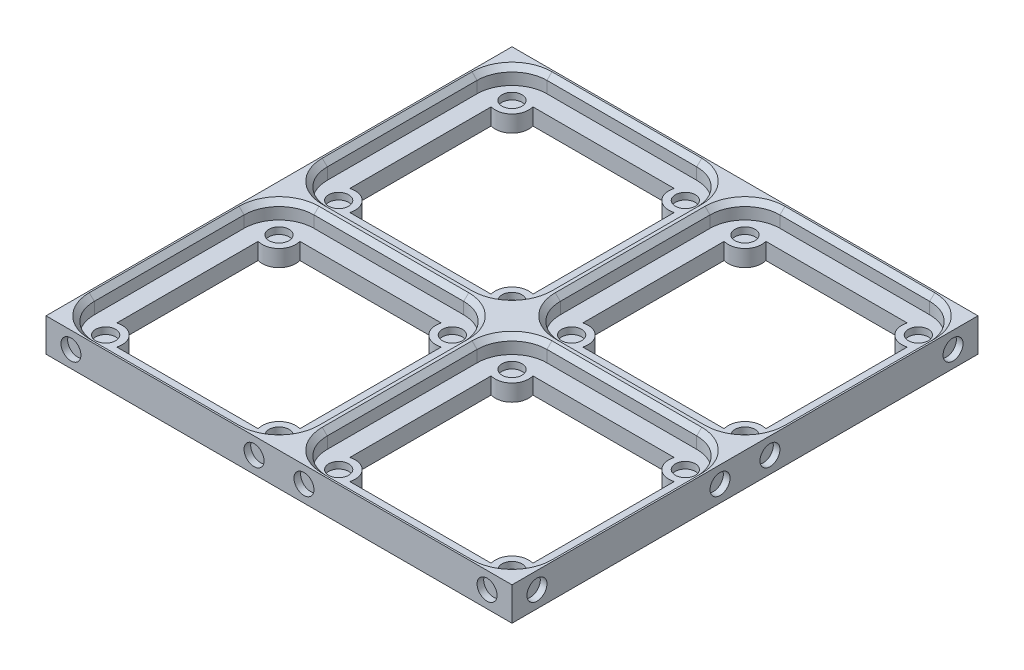
from build123d import *

# Parameters (mm, degrees)
SKETCH1_W           = 70
SKETCH1_H           = 70
BOSS_EXTRUDE2_DEPTH = 7
CUT_EXTRUDE1_DEPTH  = 5
SKETCH9_W           = 70
SKETCH9_H           = 70
BOSS_EXTRUDE3_DEPTH = 5
CUT_EXTRUDE11_DEPTH = 100.242128151
SKETCH21_R          = 3
CUT_EXTRUDE12_DEPTH = 2
CUT_EXTRUDE13_START = -2
SKETCH22_W          = 70
SKETCH22_H          = 70
CUT_EXTRUDE13_DEPTH = 2
SKETCH27_R          = 3
CUT_EXTRUDE27_DEPTH = 2
SKETCH28_R          = 3
CUT_EXTRUDE28_DEPTH = 2
CUT_EXTRUDE29_DEPTH = 5
CUT_EXTRUDE30_DEPTH = 5
CHAMFER1_SIZE       = 1.5


with BuildPart() as part:
    # Sketch1 → Boss-Extrude2 (new body)
    with BuildSketch(Plane(origin=(0, 0, 0), x_dir=(1, 0, 0), z_dir=(0, 1, 0))):
        with Locations((35, 35)):
            Rectangle(SKETCH1_W, SKETCH1_H)
    extrude(amount=BOSS_EXTRUDE2_DEPTH)

    # Sketch3 → Cut-Extrude1 (cut)
    with BuildSketch(Plane(origin=(0, 7, 0), x_dir=(1, 0, 0), z_dir=(0, 1, 0))):
        with BuildLine():
            Line((2.5, 57.5), (2.5, 12.5))
            ThreePointArc((2.5, 12.5), (5.428932188, 5.428932188), (12.5, 2.5))
            Line((12.5, 2.5), (57.5, 2.5))
            ThreePointArc((57.5, 2.5), (64.571067812, 5.428932188), (67.5, 12.5))
            Line((67.5, 12.5), (67.5, 57.5))
            ThreePointArc((67.5, 57.5), (64.571067812, 64.571067812), (57.5, 67.5))
            Line((57.5, 67.5), (12.5, 67.5))
            ThreePointArc((12.5, 67.5), (5.428932188, 64.571067812), (2.5, 57.5))
        make_face()
    extrude(amount=-CUT_EXTRUDE1_DEPTH, mode=Mode.SUBTRACT)

    # Sketch9 → Boss-Extrude3 (add)
    with BuildSketch(Plane.XZ):
        with Locations((35, -35)):
            Rectangle(SKETCH9_W, SKETCH9_H)
    extrude(amount=BOSS_EXTRUDE3_DEPTH)

    # Sketch20 → Cut-Extrude11 (cut, through all)
    with BuildSketch(Plane(origin=(0, 2, 0), x_dir=(1, 0, 0), z_dir=(0, 1, 0))):
        with BuildLine():
            Line((13.745191882, 7.5), (56.254808118, 7.5))
            ThreePointArc((56.254808118, 7.5), (57.5, 12.5), (62.5, 13.745191882))
            Line((62.5, 13.745191882), (62.5, 56.254808118))
            ThreePointArc((62.5, 56.254808118), (57.5, 57.5), (56.254808118, 62.5))
            Line((56.254808118, 62.5), (13.745191882, 62.5))
            ThreePointArc((13.745191882, 62.5), (12.5, 57.5), (7.5, 56.254808118))
            Line((7.5, 56.254808118), (7.5, 13.745191882))
            ThreePointArc((7.5, 13.745191882), (12.5, 12.5), (13.745191882, 7.5))
        make_face()
    extrude(amount=-CUT_EXTRUDE11_DEPTH, mode=Mode.SUBTRACT)

    # Sketch21 → Cut-Extrude12 (cut)
    with BuildSketch(Plane(origin=(0, 2, 0), x_dir=(1, 0, 0), z_dir=(0, 1, 0))):
        with Locations(Location((8.964466094, 61.035533906, 0), (0, 0, 270))):
            Circle(SKETCH21_R)
        with Locations(Location((61.035533906, 61.035533906, 0), (0, 0, 270))):
            Circle(SKETCH21_R)
        with Locations(Location((61.035533906, 8.964466094, 0), (0, 0, 270))):
            Circle(SKETCH21_R)
        with Locations(Location((8.964466094, 8.964466094, 0), (0, 0, 270))):
            Circle(SKETCH21_R)
    extrude(amount=-CUT_EXTRUDE12_DEPTH, mode=Mode.SUBTRACT)

    # Sketch22 → Cut-Extrude13 (cut)
    with BuildSketch(Plane.XZ.offset(5).offset(CUT_EXTRUDE13_START)):
        with Locations((35, -35)):
            Rectangle(SKETCH22_W, SKETCH22_H)
        with BuildLine():
            Line((7.5, -13.745191882), (7.5, -56.254808118))
            ThreePointArc((7.5, -56.254808118), (12.5, -57.5), (13.745191882, -62.5))
            Line((13.745191882, -62.5), (56.254808118, -62.5))
            ThreePointArc((56.254808118, -62.5), (57.5, -57.5), (62.5, -56.254808118))
            Line((62.5, -56.254808118), (62.5, -13.745191882))
            ThreePointArc((62.5, -13.745191882), (57.5, -12.5), (56.254808118, -7.5))
            Line((56.254808118, -7.5), (13.745191882, -7.5))
            ThreePointArc((13.745191882, -7.5), (12.5, -12.5), (7.5, -13.745191882))
        make_face(mode=Mode.SUBTRACT)
    extrude(amount=CUT_EXTRUDE13_DEPTH, mode=Mode.SUBTRACT)

    # Sketch27 → Cut-Extrude27 (cut)
    with BuildSketch(Plane.ZY):
        with Locations((-62.5, 2)):
            Circle(SKETCH27_R)
        with Locations((-7.5, 2)):
            Circle(SKETCH27_R)
    extrude(amount=-CUT_EXTRUDE27_DEPTH, mode=Mode.SUBTRACT)

    # Sketch28 → Cut-Extrude28 (cut)
    with BuildSketch(Plane.XY):
        with Locations((7.5, 2)):
            Circle(SKETCH28_R)
        with Locations((62.5, 2)):
            Circle(SKETCH28_R)
    extrude(amount=-CUT_EXTRUDE28_DEPTH, mode=Mode.SUBTRACT)

    # Mirror2: part across plane


with BuildPart() as part_1:
    add(part.part)
    add(part.part.mirror(Plane(origin=(0, 7, -70), x_dir=(1, 0, 0), z_dir=(0, 0, 1))))

    # Mirror3: part across plane


with BuildPart() as part_2:
    add(part_1.part)
    add(part_1.part.mirror(Plane(origin=(70, 7, 0), x_dir=(0, 0, 1), z_dir=(-1, 0, 0))))

    # Sketch30 → Cut-Extrude29 (cut)
    with BuildSketch(Plane(origin=(0, 7, 0), x_dir=(1, 0, 0), z_dir=(0, 1, 0))):
        with BuildLine():
            Line((2, 57.5), (2, 12.5))
            ThreePointArc((2, 12.5), (5.075378798, 5.075378798), (12.5, 2))
            Line((12.5, 2), (57.5, 2))
            ThreePointArc((57.5, 2), (64.924621202, 5.075378798), (68, 12.5))
            Line((68, 12.5), (68, 57.5))
            ThreePointArc((68, 57.5), (64.924621202, 64.924621202), (57.5, 68))
            Line((57.5, 68), (12.5, 68))
            ThreePointArc((12.5, 68), (5.075378798, 64.924621202), (2, 57.5))
        make_face()
    extrude(amount=-CUT_EXTRUDE29_DEPTH, mode=Mode.SUBTRACT)

    # Sketch31 → Cut-Extrude30 (cut)
    with BuildSketch(Plane(origin=(0, 7, 0), x_dir=(1, 0, 0), z_dir=(0, 1, 0))):
        with BuildLine():
            Line((68, 82.5), (68, 127.5))
            ThreePointArc((68, 127.5), (64.924621202, 134.924621202), (57.5, 138))
            Line((57.5, 138), (12.5, 138))
            ThreePointArc((12.5, 138), (5.075378798, 134.924621202), (2, 127.5))
            Line((2, 127.5), (2, 82.5))
            ThreePointArc((2, 82.5), (5.075378798, 75.075378798), (12.5, 72))
            Line((12.5, 72), (57.5, 72))
            ThreePointArc((57.5, 72), (64.924621202, 75.075378798), (68, 82.5))
        make_face()
        with BuildLine():
            Line((82.5, 72), (127.5, 72))
            ThreePointArc((127.5, 72), (134.924621202, 75.075378798), (138, 82.5))
            Line((138, 82.5), (138, 127.5))
            ThreePointArc((138, 127.5), (134.924621202, 134.924621202), (127.5, 138))
            Line((127.5, 138), (82.5, 138))
            ThreePointArc((82.5, 138), (75.075378798, 134.924621202), (72, 127.5))
            Line((72, 127.5), (72, 82.5))
            ThreePointArc((72, 82.5), (75.075378798, 75.075378798), (82.5, 72))
        make_face()
        with BuildLine():
            Line((72, 57.5), (72, 12.5))
            ThreePointArc((72, 12.5), (75.075378798, 5.075378798), (82.5, 2))
            Line((82.5, 2), (127.5, 2))
            ThreePointArc((127.5, 2), (134.924621202, 5.075378798), (138, 12.5))
            Line((138, 12.5), (138, 57.5))
            ThreePointArc((138, 57.5), (134.924621202, 64.924621202), (127.5, 68))
            Line((127.5, 68), (82.5, 68))
            ThreePointArc((82.5, 68), (75.075378798, 64.924621202), (72, 57.5))
        make_face()
    extrude(amount=-CUT_EXTRUDE30_DEPTH, mode=Mode.SUBTRACT)

    # Chamfer1
    chamfer1_edges = [part_2.edges().sort_by_distance(p)[0] for p in [
        (5.075378798, 7, -64.924621202),
        (2, 7, -35),
        (5.075378798, 7, -5.075378798),
        (35, 7, -2),
        (64.924621202, 7, -5.075378798),
        (68, 7, -35),
        (64.924621202, 7, -64.924621202),
        (35, 7, -68),
        (64.924621202, 7, -134.924621202),
        (35, 7, -138),
        (5.075378798, 7, -134.924621202),
        (2, 7, -105),
        (5.075378798, 7, -75.075378798),
        (35, 7, -72),
        (64.924621202, 7, -75.075378798),
        (68, 7, -105),
        (75.075378798, 7, -5.075378798),
        (105, 7, -2),
        (134.924621202, 7, -5.075378798),
        (138, 7, -35),
        (134.924621202, 7, -64.924621202),
        (105, 7, -68),
        (75.075378798, 7, -64.924621202),
        (72, 7, -35),
        (75.075378798, 7, -75.075378798),
        (105, 7, -72),
        (134.924621202, 7, -75.075378798),
        (138, 7, -105),
        (134.924621202, 7, -134.924621202),
        (105, 7, -138),
        (75.075378798, 7, -134.924621202),
        (72, 7, -105),
    ]]
    chamfer(chamfer1_edges, length=CHAMFER1_SIZE)


solid = part_2.part
